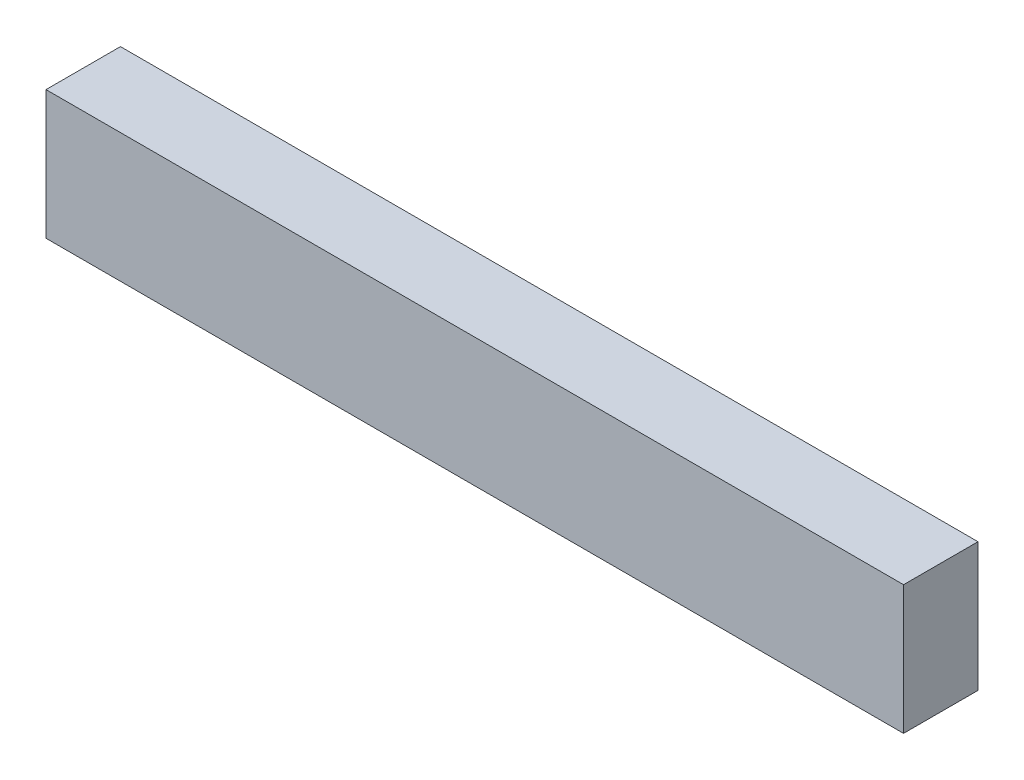
from build123d import *

# Parameters (mm, degrees)
SKETCH1_W                 = 83.50130149
SKETCH1_H                 = 12.54
BOSS_EXTRUDE1_DEPTH       = 7.25
SHELL1_T                  = -0.5
SHELL1_THICKNESS_2_FACE_W = 82.50130149
SHELL1_THICKNESS_2_FACE_H = 11.54
SHELL1_THICKNESS_2_DEPTH  = 0.3


with BuildPart() as part:
    # Sketch1 → Boss-Extrude1 (new body)
    with BuildSketch(Plane.XY):
        with Locations((-37.286150745, 55.8)):
            Rectangle(SKETCH1_W, SKETCH1_H)
    extrude(amount=BOSS_EXTRUDE1_DEPTH)

    # Shell1
    shell1_openings = [part.faces().sort_by_distance(p)[0] for p in [
        (-37.286150745, 55.8, 0),
    ]]
    offset(amount=SHELL1_T, openings=shell1_openings, kind=Kind.INTERSECTION)

    # Shell1 thickness 2 face (on inner face of the shell) → Shell1 thickness 2 (cut)
    with BuildSketch(Plane(origin=(-37.286150745, 55.8, 6.75), x_dir=(1, 0, 0), z_dir=(0, 0, 1))):
        Rectangle(SHELL1_THICKNESS_2_FACE_W, SHELL1_THICKNESS_2_FACE_H)
    extrude(amount=SHELL1_THICKNESS_2_DEPTH, mode=Mode.SUBTRACT)


solid = part.part
